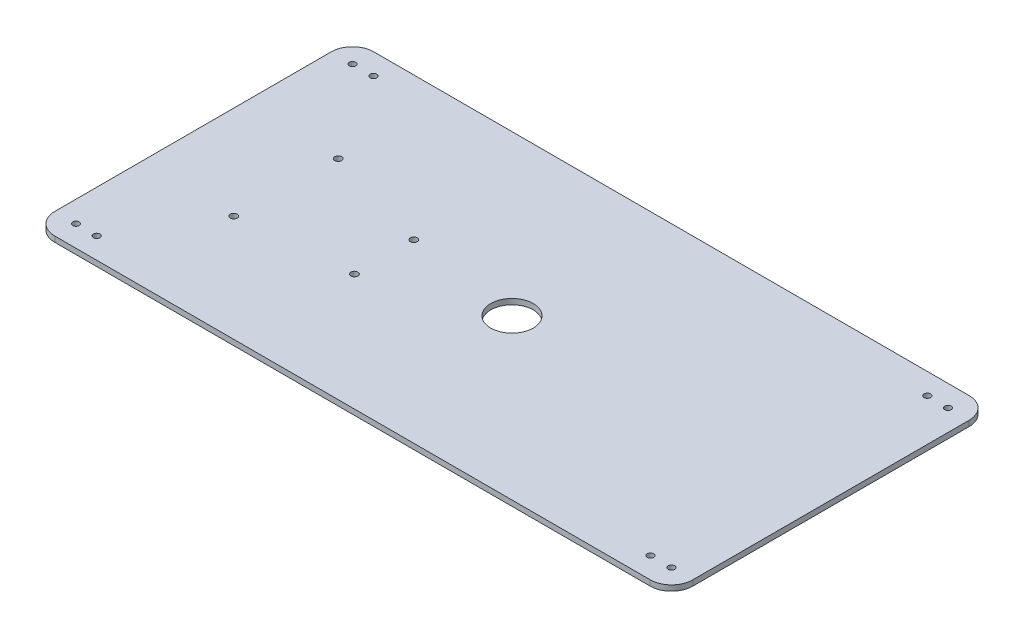
from build123d import *

# Parameters (mm, degrees)
SKETCH1_W               = 300
SKETCH1_H               = 150
BOSS_EXTRUDE1_DEPTH     = 2.6
FILLET1_R               = 10
SKETCH6_R               = 1.5
CUT_EXTRUDE6_DEPTH      = 2.6
MIRROR6_COPY_1_SKETCH_R = 1.5
MIRROR6_COPY_1_DEPTH    = 2.6
SKETCH16_R              = 1.61925
CUT_EXTRUDE9_DEPTH      = 10
SKETCH17_R              = 1.61925
CUT_EXTRUDE10_DEPTH     = 336.420273687
SKETCH18_R              = 1.61925
CUT_EXTRUDE11_DEPTH     = 336.420273687
SKETCH19_R              = 1.61925
CUT_EXTRUDE12_DEPTH     = 336.420273687
SKETCH15_R              = 10
CUT_EXTRUDE14_DEPTH     = 336.420273687
SKETCH23_R              = 1.524
CUT_EXTRUDE15_DEPTH     = 2.59999988
MIRROR8_COPY_1_SKETCH_R = 1.524
MIRROR8_COPY_1_DEPTH    = 2.59999988


with BuildPart() as part:
    # Sketch1 → Boss-Extrude1 (new body)
    with BuildSketch(Plane(origin=(0, 0, 0), x_dir=(1, 0, 0), z_dir=(0, 1, 0))):
        with Locations((150, -75)):
            Rectangle(SKETCH1_W, SKETCH1_H)
    extrude(amount=BOSS_EXTRUDE1_DEPTH)

    # Fillet1
    fillet1_edges = [part.edges().sort_by_distance(p)[0] for p in [
        (0, 1.3, 0),
        (300, 1.3, 0),
        (300, 1.3, 150),
        (0, 1.3, 150),
    ]]
    fillet(fillet1_edges, radius=FILLET1_R)

    # Sketch6 → Cut-Extrude6 (cut)
    with BuildSketch(Plane.XZ):
        with Locations(Location((290, 10, 0), (0, 0, 270))):
            Circle(SKETCH6_R)
    cut_extrude6 = extrude(amount=-CUT_EXTRUDE6_DEPTH, mode=Mode.SUBTRACT)

    # Mirror5: Cut-Extrude6 across plane
    add(cut_extrude6.mirror(Plane(origin=(150, 0, 0), x_dir=(0, 0, 1), z_dir=(1, 0, 0))), mode=Mode.SUBTRACT)

    # Mirror6: Cut-Extrude6 across plane
    add(cut_extrude6.mirror(Plane.XY.offset(75)), mode=Mode.SUBTRACT)

    # Mirror6 copy 1 sketch → Mirror6 copy 1 (cut)
    with BuildSketch(Plane(origin=(300, 0, 150), x_dir=(-1, 0, 0), z_dir=(0, -1, 0))):
        with Locations(Location((290, 10, 0), (0, 0, 270))):
            Circle(MIRROR6_COPY_1_SKETCH_R)
    extrude(amount=-MIRROR6_COPY_1_DEPTH, mode=Mode.SUBTRACT)

    # Sketch16 → Cut-Extrude9 (cut)
    with BuildSketch(Plane(origin=(0, 2.6, 0), x_dir=(1, 0, 0), z_dir=(0, 1, 0))):
        with Locations(Location((45.15745, -51.87145, 0), (0, 0, 270))):
            Circle(SKETCH16_R)
    extrude(amount=-CUT_EXTRUDE9_DEPTH, mode=Mode.SUBTRACT)

    # Sketch17 → Cut-Extrude10 (cut, through all)
    with BuildSketch(Plane(origin=(0, 2.6, 0), x_dir=(1, 0, 0), z_dir=(0, 1, 0))):
        with Locations(Location((95.94475, -67.11145, 0), (0, 0, 270))):
            Circle(SKETCH17_R)
    extrude(amount=-CUT_EXTRUDE10_DEPTH, mode=Mode.SUBTRACT)

    # Sketch18 → Cut-Extrude11 (cut, through all)
    with BuildSketch(Plane(origin=(0, 2.6, 0), x_dir=(1, 0, 0), z_dir=(0, 1, 0))):
        with Locations(Location((44.01445, -99.78855, 0), (0, 0, 270))):
            Circle(SKETCH18_R)
    extrude(amount=-CUT_EXTRUDE11_DEPTH, mode=Mode.SUBTRACT)

    # Sketch19 → Cut-Extrude12 (cut, through all)
    with BuildSketch(Plane(origin=(0, 2.6, 0), x_dir=(1, 0, 0), z_dir=(0, 1, 0))):
        with Locations(Location((95.94475, -95.03875, 0), (0, 0, 270))):
            Circle(SKETCH19_R)
    extrude(amount=-CUT_EXTRUDE12_DEPTH, mode=Mode.SUBTRACT)

    # Sketch15 → Cut-Extrude14 (cut, through all)
    with BuildSketch(Plane.XZ):
        with Locations(Location((150, 75, 0), (0, 0, 270))):
            Circle(SKETCH15_R)
    extrude(amount=-CUT_EXTRUDE14_DEPTH, mode=Mode.SUBTRACT)

    # Sketch23 → Cut-Extrude15 (cut)
    with BuildSketch(Plane(origin=(0, 2.6, 0), x_dir=(1, 0, 0), z_dir=(0, 1, 0))):
        with Locations(Location((19.812, -9.906, 0), (0, 0, 270))):
            Circle(SKETCH23_R)
    cut_extrude15 = extrude(amount=-CUT_EXTRUDE15_DEPTH, mode=Mode.SUBTRACT)

    # Mirror7: Cut-Extrude15 across plane
    add(cut_extrude15.mirror(Plane(origin=(150, 0, 0), x_dir=(0, 0, 1), z_dir=(1, 0, 0))), mode=Mode.SUBTRACT)

    # Mirror8: Cut-Extrude15 across plane
    add(cut_extrude15.mirror(Plane.XY.offset(75)), mode=Mode.SUBTRACT)

    # Mirror8 copy 1 sketch → Mirror8 copy 1 (cut)
    with BuildSketch(Plane(origin=(300, 2.6, 150), x_dir=(-1, 0, 0), z_dir=(0, 1, 0))):
        with Locations(Location((19.812, -9.906, 0), (0, 0, 270))):
            Circle(MIRROR8_COPY_1_SKETCH_R)
    extrude(amount=-MIRROR8_COPY_1_DEPTH, mode=Mode.SUBTRACT)


solid = part.part
